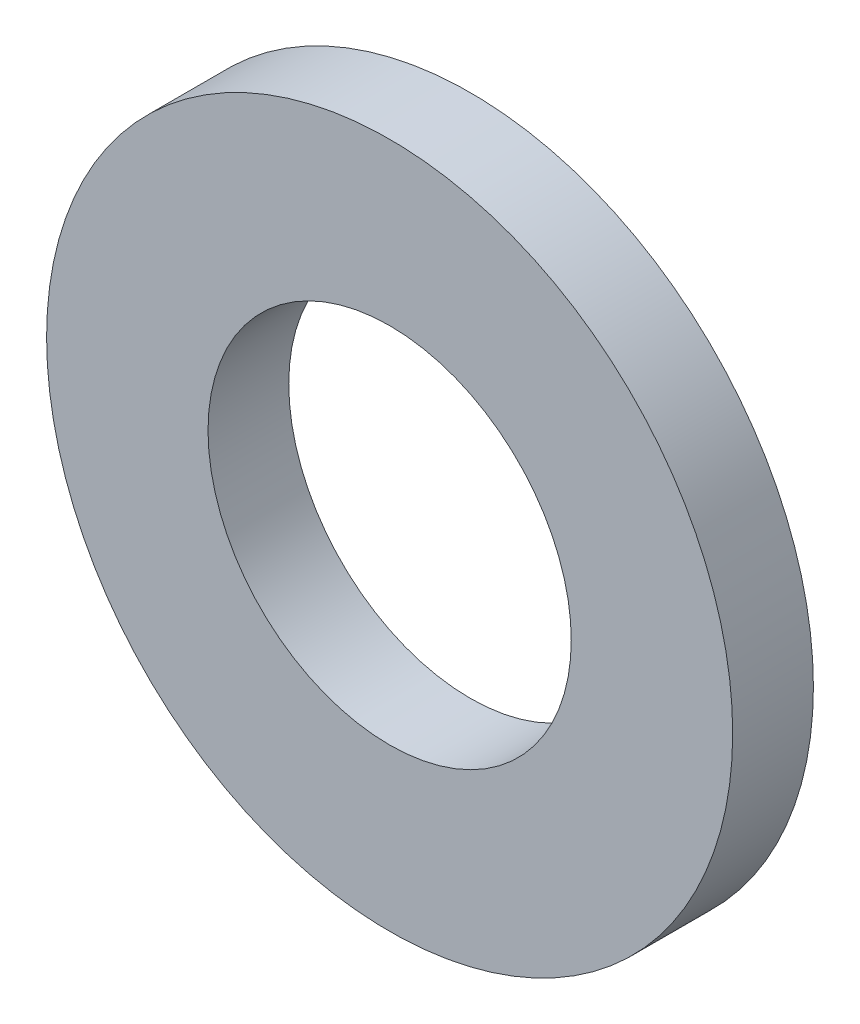
from build123d import *

# Parameters (mm, degrees)
SKETCH1_R           = 4.25
SKETCH1_R_2         = 2.25
BOSS_EXTRUDE1_DEPTH = 1


with BuildPart() as part:
    # Sketch1 → Boss-Extrude1 (new body)
    with BuildSketch(Plane.XY):
        Circle(SKETCH1_R)
        Circle(SKETCH1_R_2, mode=Mode.SUBTRACT)
    extrude(amount=BOSS_EXTRUDE1_DEPTH)


solid = part.part
